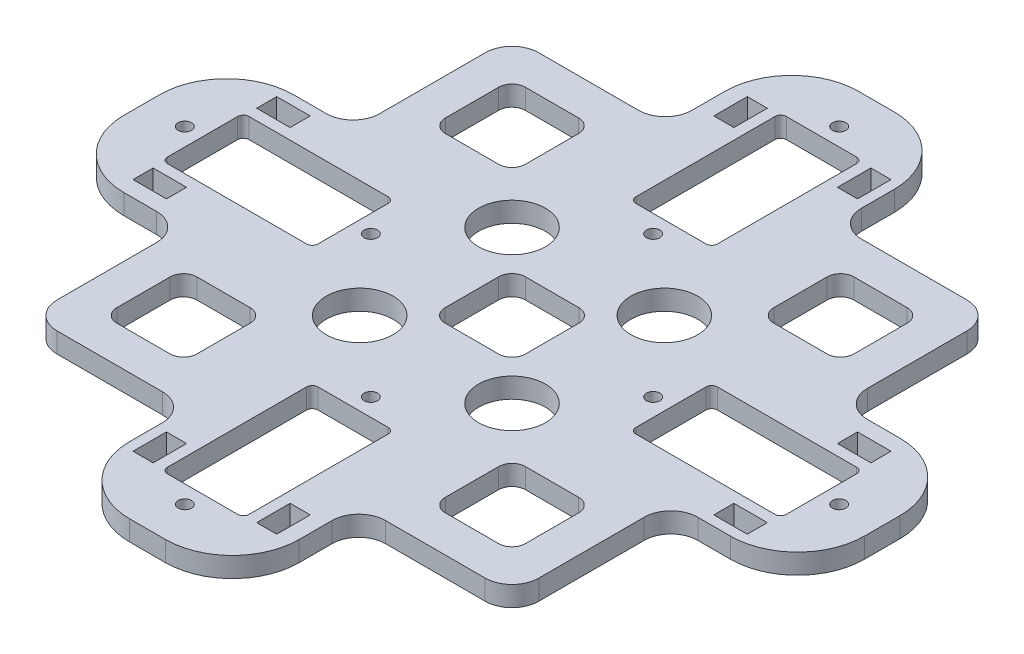
from build123d import *

# Parameters (mm, degrees)
SKETCH2_R           = 1
BOSS_EXTRUDE1_DEPTH = 3
FILLET1_R           = 4
SKETCH4_R           = 5
CUT_EXTRUDE1_DEPTH  = 3
SKETCH5_W           = 5
SKETCH5_H           = 3
SKETCH5_W_2         = 3
SKETCH5_H_2         = 5
CUT_EXTRUDE2_DEPTH  = 3


with BuildPart() as part:
    # Sketch2 → Boss-Extrude1 (new body)
    with BuildSketch(Plane(origin=(0, 0, 0), x_dir=(1, 0, 0), z_dir=(0, 1, 0))):
        with BuildLine():
            Line((13.1, -44.9), (13.1, -36))
            Line((13.1, -36), (36, -36))
            Line((36, -36), (36, -12.237658296))
            Line((36, -12.237658296), (44.9, -12.237658296))
            ThreePointArc((44.9, -12.237658296), (51.971067812, -9.308726108), (54.9, -2.237658296))
            Line((54.9, -2.237658296), (54.9, 3.1))
            ThreePointArc((54.9, 3.1), (51.971067812, 10.171067812), (44.9, 13.1))
            Line((44.9, 13.1), (36, 13.1))
            Line((36, 13.1), (36, 36))
            Line((36, 36), (12.237658296, 36))
            Line((12.237658296, 36), (12.237658296, 44.9))
            ThreePointArc((12.237658296, 44.9), (9.308726108, 51.971067812), (2.237658296, 54.9))
            Line((2.237658296, 54.9), (-3.1, 54.9))
            ThreePointArc((-3.1, 54.9), (-10.171067812, 51.971067812), (-13.1, 44.9))
            Line((-13.1, 44.9), (-13.1, 36))
            Line((-13.1, 36), (-36, 36))
            Line((-36, 36), (-36, 12.237658296))
            Line((-36, 12.237658296), (-44.9, 12.237658296))
            ThreePointArc((-44.9, 12.237658296), (-51.971067812, 9.308726108), (-54.9, 2.237658296))
            Line((-54.9, 2.237658296), (-54.9, -3.1))
            ThreePointArc((-54.9, -3.1), (-51.971067812, -10.171067812), (-44.9, -13.1))
            Line((-44.9, -13.1), (-36, -13.1))
            Line((-36, -13.1), (-36, -36))
            Line((-36, -36), (-12.237658296, -36))
            Line((-12.237658296, -36), (-12.237658296, -44.9))
            ThreePointArc((-12.237658296, -44.9), (-9.308726108, -51.971067812), (-2.237658296, -54.9))
            Line((-2.237658296, -54.9), (3.1, -54.9))
            ThreePointArc((3.1, -54.9), (10.171067812, -51.971067812), (13.1, -44.9))
        make_face()
        with Locations(Location((-48.9, 0, 0), (0, 0, 270))):
            Circle(SKETCH2_R, mode=Mode.SUBTRACT)
        with BuildLine():
            Line((-45.4, 6.1), (-24.6, 6.1))
            ThreePointArc((-24.6, 6.1), (-23.998959236, 5.851040764), (-23.75, 5.25))
            Line((-23.75, 5.25), (-23.75, -5.25))
            ThreePointArc((-23.75, -5.25), (-23.998959236, -5.851040764), (-24.6, -6.1))
            Line((-24.6, -6.1), (-45.4, -6.1))
            ThreePointArc((-45.4, -6.1), (-46.001040764, -5.851040764), (-46.25, -5.25))
            Line((-46.25, -5.25), (-46.25, 5.25))
            ThreePointArc((-46.25, 5.25), (-46.001040764, 5.851040764), (-45.4, 6.1))
        make_face(mode=Mode.SUBTRACT)
        with Locations(Location((-21.1, 0, 0), (0, 0, 270))):
            Circle(SKETCH2_R, mode=Mode.SUBTRACT)
        with Locations(Location((0, -48.9, 0), (0, 0, 270))):
            Circle(SKETCH2_R, mode=Mode.SUBTRACT)
        with BuildLine():
            Line((-6.1, -45.4), (-6.1, -24.6))
            ThreePointArc((-6.1, -24.6), (-5.851040764, -23.998959236), (-5.25, -23.75))
            Line((-5.25, -23.75), (5.25, -23.75))
            ThreePointArc((5.25, -23.75), (5.851040764, -23.998959236), (6.1, -24.6))
            Line((6.1, -24.6), (6.1, -45.4))
            ThreePointArc((6.1, -45.4), (5.851040764, -46.001040764), (5.25, -46.25))
            Line((5.25, -46.25), (-5.25, -46.25))
            ThreePointArc((-5.25, -46.25), (-5.851040764, -46.001040764), (-6.1, -45.4))
        make_face(mode=Mode.SUBTRACT)
        with Locations(Location((0, -21.1, 0), (0, 0, 270))):
            Circle(SKETCH2_R, mode=Mode.SUBTRACT)
        with BuildLine():
            ThreePointArc((6, -4), (5.414213562, -5.414213562), (4, -6))
            Line((4, -6), (-4, -6))
            ThreePointArc((-4, -6), (-5.414213562, -5.414213562), (-6, -4))
            Line((-6, -4), (-6, 4))
            ThreePointArc((-6, 4), (-5.414213562, 5.414213562), (-4, 6))
            Line((-4, 6), (4, 6))
            ThreePointArc((4, 6), (5.414213562, 5.414213562), (6, 4))
            Line((6, 4), (6, -4))
        make_face(mode=Mode.SUBTRACT)
        with Locations(Location((0, 21.1, 0), (0, 0, 270))):
            Circle(SKETCH2_R, mode=Mode.SUBTRACT)
        with BuildLine():
            ThreePointArc((6.1, 24.6), (5.851040764, 23.998959236), (5.25, 23.75))
            Line((5.25, 23.75), (-5.25, 23.75))
            ThreePointArc((-5.25, 23.75), (-5.851040764, 23.998959236), (-6.1, 24.6))
            Line((-6.1, 24.6), (-6.1, 45.4))
            ThreePointArc((-6.1, 45.4), (-5.851040764, 46.001040764), (-5.25, 46.25))
            Line((-5.25, 46.25), (5.25, 46.25))
            ThreePointArc((5.25, 46.25), (5.851040764, 46.001040764), (6.1, 45.4))
            Line((6.1, 45.4), (6.1, 24.6))
        make_face(mode=Mode.SUBTRACT)
        with Locations(Location((0, 48.9, 0), (0, 0, 270))):
            Circle(SKETCH2_R, mode=Mode.SUBTRACT)
        with Locations(Location((21.1, 0, 0), (0, 0, 270))):
            Circle(SKETCH2_R, mode=Mode.SUBTRACT)
        with BuildLine():
            Line((45.4, -6.1), (24.6, -6.1))
            ThreePointArc((24.6, -6.1), (23.998959236, -5.851040764), (23.75, -5.25))
            Line((23.75, -5.25), (23.75, 5.25))
            ThreePointArc((23.75, 5.25), (23.998959236, 5.851040764), (24.6, 6.1))
            Line((24.6, 6.1), (45.4, 6.1))
            ThreePointArc((45.4, 6.1), (46.001040764, 5.851040764), (46.25, 5.25))
            Line((46.25, 5.25), (46.25, -5.25))
            ThreePointArc((46.25, -5.25), (46.001040764, -5.851040764), (45.4, -6.1))
        make_face(mode=Mode.SUBTRACT)
        with Locations(Location((48.9, 0, 0), (0, 0, 270))):
            Circle(SKETCH2_R, mode=Mode.SUBTRACT)
        with BuildLine():
            ThreePointArc((28.535, -18.560920379), (29.949213562, -19.146706817), (30.535, -20.560920379))
            Line((30.535, -20.560920379), (30.535, -28.535))
            ThreePointArc((30.535, -28.535), (29.949213562, -29.949213562), (28.535, -30.535))
            Line((28.535, -30.535), (20.560920379, -30.535))
            ThreePointArc((20.560920379, -30.535), (19.146706817, -29.949213562), (18.560920379, -28.535))
            Line((18.560920379, -28.535), (18.560920379, -20.560920379))
            ThreePointArc((18.560920379, -20.560920379), (19.146706817, -19.146706817), (20.560920379, -18.560920379))
            Line((20.560920379, -18.560920379), (28.535, -18.560920379))
        make_face(mode=Mode.SUBTRACT)
        with BuildLine():
            ThreePointArc((20.560920379, 18.560920379), (19.146706817, 19.146706817), (18.560920379, 20.560920379))
            Line((18.560920379, 20.560920379), (18.560920379, 28.535))
            ThreePointArc((18.560920379, 28.535), (19.146706817, 29.949213562), (20.560920379, 30.535))
            Line((20.560920379, 30.535), (28.535, 30.535))
            ThreePointArc((28.535, 30.535), (29.949213562, 29.949213562), (30.535, 28.535))
            Line((30.535, 28.535), (30.535, 20.560920379))
            ThreePointArc((30.535, 20.560920379), (29.949213562, 19.146706817), (28.535, 18.560920379))
            Line((28.535, 18.560920379), (20.560920379, 18.560920379))
        make_face(mode=Mode.SUBTRACT)
        with BuildLine():
            ThreePointArc((-20.560920379, -18.560920379), (-19.146706817, -19.146706817), (-18.560920379, -20.560920379))
            Line((-18.560920379, -20.560920379), (-18.560920379, -28.535))
            ThreePointArc((-18.560920379, -28.535), (-19.146706817, -29.949213562), (-20.560920379, -30.535))
            Line((-20.560920379, -30.535), (-28.535, -30.535))
            ThreePointArc((-28.535, -30.535), (-29.949213562, -29.949213562), (-30.535, -28.535))
            Line((-30.535, -28.535), (-30.535, -20.560920379))
            ThreePointArc((-30.535, -20.560920379), (-29.949213562, -19.146706817), (-28.535, -18.560920379))
            Line((-28.535, -18.560920379), (-20.560920379, -18.560920379))
        make_face(mode=Mode.SUBTRACT)
        with BuildLine():
            Line((-20.560920379, 18.560920379), (-28.535, 18.560920379))
            ThreePointArc((-28.535, 18.560920379), (-29.949213562, 19.146706817), (-30.535, 20.560920379))
            Line((-30.535, 20.560920379), (-30.535, 28.535))
            ThreePointArc((-30.535, 28.535), (-29.949213562, 29.949213562), (-28.535, 30.535))
            Line((-28.535, 30.535), (-20.560920379, 30.535))
            ThreePointArc((-20.560920379, 30.535), (-19.146706817, 29.949213562), (-18.560920379, 28.535))
            Line((-18.560920379, 28.535), (-18.560920379, 20.560920379))
            ThreePointArc((-18.560920379, 20.560920379), (-19.146706817, 19.146706817), (-20.560920379, 18.560920379))
        make_face(mode=Mode.SUBTRACT)
    extrude(amount=BOSS_EXTRUDE1_DEPTH)

    # Fillet1
    fillet1_edges = [part.edges().sort_by_distance(p)[0] for p in [
        (-36, 1.5, 36),
        (-36, 1.5, 13.1),
        (-36, 1.5, -12.237658296),
        (-36, 1.5, -36),
        (-13.1, 1.5, -36),
        (12.237658296, 1.5, -36),
        (36, 1.5, -36),
        (36, 1.5, -13.1),
        (36, 1.5, 12.237658296),
        (36, 1.5, 36),
        (13.1, 1.5, 36),
        (-12.237658296, 1.5, 36),
    ]]
    fillet(fillet1_edges, radius=FILLET1_R)

    # Sketch4 → Cut-Extrude1 (cut)
    with BuildSketch(Plane(origin=(0, 3, 0), x_dir=(1, 0, 0), z_dir=(0, 1, 0))):
        with Locations(Location((-11.382757944, 11.382757944, 0), (0, 0, 270))):
            Circle(SKETCH4_R)
        with Locations(Location((11.382757944, 11.382757944, 0), (0, 0, 270))):
            Circle(SKETCH4_R)
        with Locations(Location((11.382757944, -11.382757944, 0), (0, 0, 270))):
            Circle(SKETCH4_R)
        with Locations(Location((-11.382757944, -11.382757944, 0), (0, 0, 270))):
            Circle(SKETCH4_R)
    extrude(amount=-CUT_EXTRUDE1_DEPTH, mode=Mode.SUBTRACT)

    # Sketch5 → Cut-Extrude2 (cut)
    with BuildSketch(Plane(origin=(0, 3, 0), x_dir=(1, 0, 0), z_dir=(0, 1, 0))):
        with Locations((-43.4, 9.237658296)):
            Rectangle(SKETCH5_W, SKETCH5_H)
        with Locations((-43.4, -9.237658296)):
            Rectangle(SKETCH5_W, SKETCH5_H)
        with Locations((9.237658296, 43.4)):
            Rectangle(SKETCH5_W_2, SKETCH5_H_2)
        with Locations((-9.237658296, 43.4)):
            Rectangle(SKETCH5_W_2, SKETCH5_H_2)
        with Locations((43.4, -9.237658296)):
            Rectangle(SKETCH5_W, SKETCH5_H)
        with Locations((43.4, 9.237658296)):
            Rectangle(SKETCH5_W, SKETCH5_H)
        with Locations((-9.237658296, -43.4)):
            Rectangle(SKETCH5_W_2, SKETCH5_H_2)
        with Locations((9.237658296, -43.4)):
            Rectangle(SKETCH5_W_2, SKETCH5_H_2)
    extrude(amount=-CUT_EXTRUDE2_DEPTH, mode=Mode.SUBTRACT)


solid = part.part
